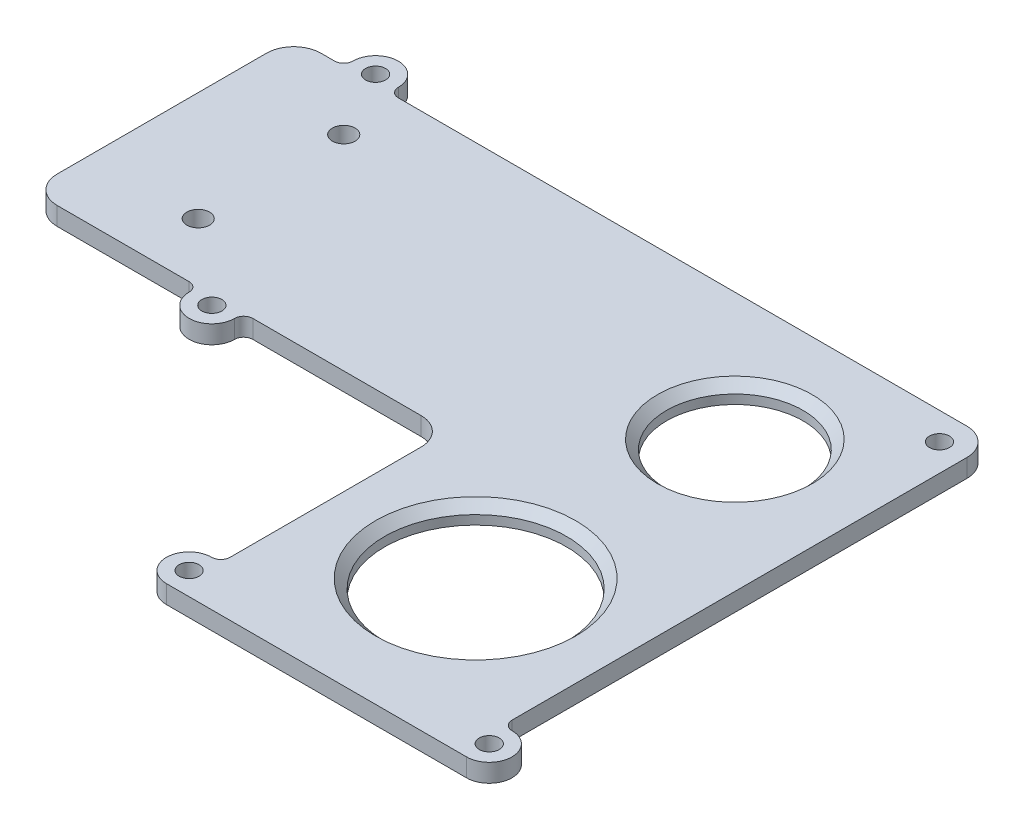
from build123d import *

# Parameters (mm, degrees)
CROQUIS1_R              = 10
CROQUIS1_R_2            = 7.5
CROQUIS1_R_3            = 1.1
SALIENTE_EXTRUIR1_DEPTH = 2
CHAFL_N1_SIZE           = 1
CROQUIS2_R              = 1.25
CORTAR_EXTRUIR1_DEPTH   = 78.628925022


with BuildPart() as part:
    # Croquis1 → Saliente-Extruir1 (new body)
    with BuildSketch(Plane(origin=(0, 0, 0), x_dir=(1, 0, 0), z_dir=(0, 1, 0))):
        with BuildLine():
            Line((-43, 30), (-28.5, 30))
            ThreePointArc((-28.5, 30), (-27.792893219, 29.707106781), (-27.5, 29))
            ThreePointArc((-27.5, 29), (-25, 26.5), (-22.5, 29))
            ThreePointArc((-22.5, 29), (-22.207106781, 29.707106781), (-21.5, 30))
            Line((-21.5, 30), (-3, 30))
            ThreePointArc((-3, 30), (-0.878679656, 29.121320344), (0, 27))
            Line((0, 27), (0, 6))
            ThreePointArc((0, 6), (-0.292893219, 5.292893219), (-1, 5))
            ThreePointArc((-1, 5), (-3.5, 2.5), (-1, 0))
            Line((-1, 0), (0, 0))
            Line((0, 0), (31, 0))
            Line((31, 0), (32, 0))
            ThreePointArc((32, 0), (34.5, 2.5), (32, 5))
            ThreePointArc((32, 5), (31.292893219, 5.292893219), (31, 6))
            Line((31, 6), (31, 56))
            ThreePointArc((31, 56), (30.121320344, 58.121320344), (28, 59))
            Line((28, 59), (-34.5, 59))
            ThreePointArc((-34.5, 59), (-35.207106781, 59.292893219), (-35.5, 60))
            ThreePointArc((-35.5, 60), (-38, 62.5), (-40.5, 60))
            ThreePointArc((-40.5, 60), (-40.792893219, 59.292893219), (-41.5, 59))
            Line((-41.5, 59), (-43, 59))
            ThreePointArc((-43, 59), (-45.121320344, 58.121320344), (-46, 56))
            Line((-46, 56), (-46, 33))
            ThreePointArc((-46, 33), (-45.121320344, 30.878679656), (-43, 30))
        make_face()
        with Locations(Location((15.5, 17.5, 0), (0, 0, 270))):
            Circle(CROQUIS1_R, mode=Mode.SUBTRACT)
        with Locations(Location((16.5, 45, 0), (0, 0, 270))):
            Circle(CROQUIS1_R_2, mode=Mode.SUBTRACT)
        with Locations(Location((32, 2.5, 0), (0, 0, 270))):
            Circle(CROQUIS1_R_3, mode=Mode.SUBTRACT)
        with Locations(Location((-38, 60, 0), (0, 0, 270))):
            Circle(CROQUIS1_R_3, mode=Mode.SUBTRACT)
        with Locations(Location((-1, 2.5, 0), (0, 0, 90))):
            Circle(CROQUIS1_R_3, mode=Mode.SUBTRACT)
        with Locations(Location((-25, 29, 0), (0, 0, 90))):
            Circle(CROQUIS1_R_3, mode=Mode.SUBTRACT)
        with Locations(Location((28, 56, 0), (0, 0, 270))):
            Circle(CROQUIS1_R_3, mode=Mode.SUBTRACT)
    extrude(amount=SALIENTE_EXTRUIR1_DEPTH)

    # Chaflán1
    chafl_n1_edges = [part.edges().sort_by_distance(p)[0] for p in [
        (15.5, 2, -27.5),
        (16.5, 2, -52.5),
    ]]
    chamfer(chafl_n1_edges, length=CHAFL_N1_SIZE)

    # Croquis2 → Cortar-Extruir1 (cut, through all)
    with BuildSketch(Plane(origin=(0, 2, 0), x_dir=(1, 0, 0), z_dir=(0, 1, 0))):
        with Locations(Location((-34, 52.5, 0), (0, 0, 270))):
            Circle(CROQUIS2_R)
        with Locations(Location((-34, 36.5, 0), (0, 0, 270))):
            Circle(CROQUIS2_R)
    extrude(amount=-CORTAR_EXTRUIR1_DEPTH, mode=Mode.SUBTRACT)


solid = part.part
